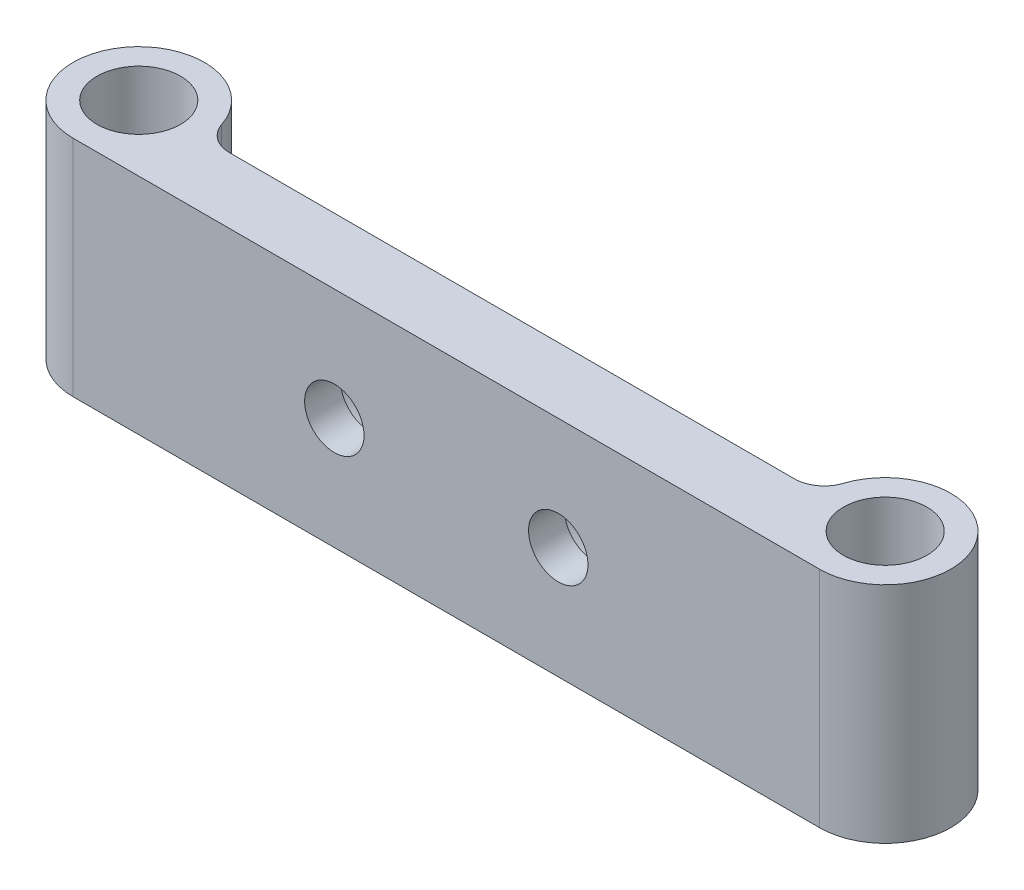
from build123d import *

# Parameters (mm, degrees)
SKETCH1_R                      = 3.556
BOSS_EXTRUDE1_DEPTH            = 19.05
FILLET2_R                      = 2.54
F_8_0_199_DIAMETER_HOLE1_D     = 5.0546
F_8_0_199_DIAMETER_HOLE1_DEPTH = 9.149444958
F_8_0_199_DIAMETER_HOLE1_TIP   = 1.518555042
SKETCH11_R                     = 5.08
CUT_EXTRUDE1_DEPTH             = 2.54


with BuildPart() as part:
    # Sketch1 → Boss-Extrude1 (new body)
    with BuildSketch(Plane(origin=(0, 0, 0), x_dir=(1, 0, 0), z_dir=(0, 1, 0))):
        with BuildLine():
            Line((-31.75, 0), (31.75, 0))
            ThreePointArc((31.75, 0), (35.701312693, 9.539312693), (26.162, 5.588))
            Line((26.162, 5.588), (-26.162, 5.588))
            ThreePointArc((-26.162, 5.588), (-35.701312693, 9.539312693), (-31.75, 0))
        make_face()
        with Locations(Location((31.75, 5.588, 0), (0, 0, 90))):
            Circle(SKETCH1_R, mode=Mode.SUBTRACT)
        with Locations(Location((-31.75, 5.588, 0), (0, 0, 90))):
            Circle(SKETCH1_R, mode=Mode.SUBTRACT)
    extrude(amount=BOSS_EXTRUDE1_DEPTH)

    # Fillet2
    fillet2_edges = [part.edges().sort_by_distance(p)[0] for p in [
        (-26.162, 9.525, -5.588),
        (26.162, 9.525, -5.588),
    ]]
    fillet(fillet2_edges, radius=FILLET2_R)

    # #8 (0.199) Diameter Hole1
    with Locations(Plane.XY):
        with Locations((-9.525, 9.525), (9.525, 9.525)):
            Hole(F_8_0_199_DIAMETER_HOLE1_D / 2, depth=F_8_0_199_DIAMETER_HOLE1_DEPTH)
            with Locations((0, 0, -(F_8_0_199_DIAMETER_HOLE1_DEPTH + F_8_0_199_DIAMETER_HOLE1_TIP / 2))):  # 118° drill point
                Cone(0, F_8_0_199_DIAMETER_HOLE1_D / 2, F_8_0_199_DIAMETER_HOLE1_TIP, mode=Mode.SUBTRACT)

    # Sketch11 → Cut-Extrude1 (cut)
    with BuildSketch(Plane(origin=(0, 0, -5.588), x_dir=(-1, 0, 0), z_dir=(0, 0, -1))):
        with Locations((-9.525, 9.525)):
            Circle(SKETCH11_R)
        with Locations((9.525, 9.525)):
            Circle(SKETCH11_R)
    extrude(amount=-CUT_EXTRUDE1_DEPTH, mode=Mode.SUBTRACT)


solid = part.part
